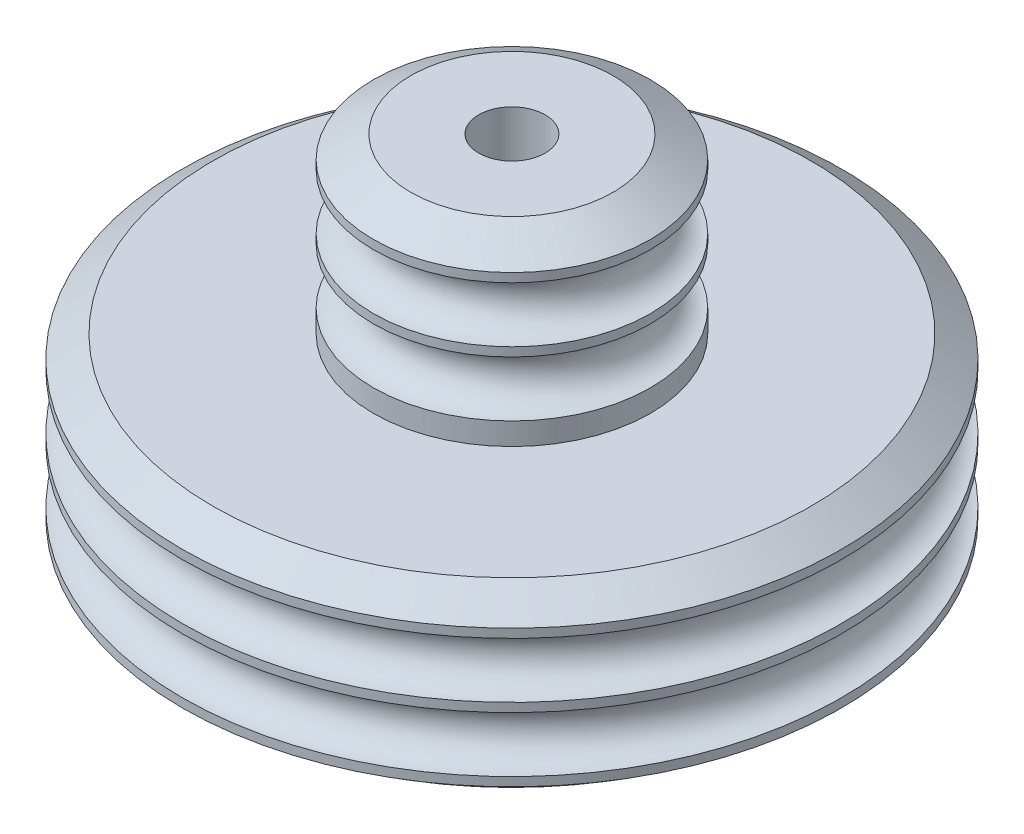
from build123d import *


with BuildPart() as part:
    # Sketch1 → Revolve1 (revolve)
    with BuildSketch(Plane.XY, mode=Mode.PRIVATE) as revolve1_sk:
        with BuildLine():
            Line((-3, -0.292676949), (-12.5, -0.292676949))
            Line((-12.5, -0.292676949), (-15.75, 5.707323051))
            Line((-15.75, 5.707323051), (-20.75, 5.707323051))
            Line((-20.75, 5.707323051), (-23.998413661, -0.292676949))
            Line((-23.998413661, -0.292676949), (-26.998413661, -0.292676949))
            Line((-26.998413661, -0.292676949), (-29.75, 1.707323051))
            Line((-29.75, 1.707323051), (-29.75, 2.507323051))
            ThreePointArc((-29.75, 2.507323051), (-27.25, 5.007323051), (-29.75, 7.507323051))
            Line((-29.75, 7.507323051), (-29.75, 8.307323051))
            ThreePointArc((-29.75, 8.307323051), (-27.25, 10.807323051), (-29.75, 13.307323051))
            Line((-29.75, 13.307323051), (-29.75, 14.107323051))
            Line((-29.75, 14.107323051), (-27, 16.107323051))
            Line((-27, 16.107323051), (-12.5, 16.107323051))
            Line((-12.5, 16.107323051), (-12.5, 18.107323051))
            ThreePointArc((-12.5, 18.107323051), (-10, 20.607323051), (-12.5, 23.107323051))
            Line((-12.5, 23.107323051), (-12.5, 23.907323051))
            ThreePointArc((-12.5, 23.907323051), (-10, 26.407323051), (-12.5, 28.907323051))
            Line((-12.5, 28.907323051), (-12.5, 29.707323051))
            Line((-12.5, 29.707323051), (-9.131859058, 31.707323051))
            Line((-9.131859058, 31.707323051), (-3, 31.707323051))
            Line((-3, 31.707323051), (-3, -0.292676949))
        make_face()
    revolve(revolve1_sk.sketch.rotate(Axis((0, 20.813518201, 0), (0, -1, 0)), 270), axis=Axis((0, 20.813518201, 0), (0, -1, 0)))


solid = part.part
